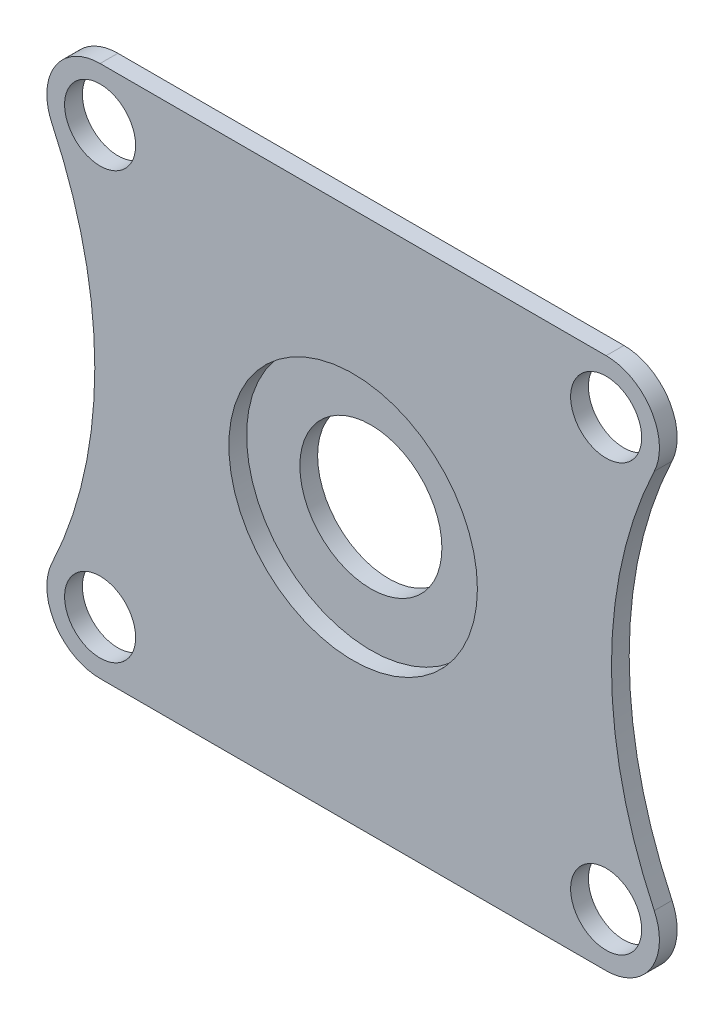
from build123d import *

# Parameters (mm, degrees)
SKETCH_2_R          = 2
EXTRUDE_1_DEPTH     = 1
FILLET_1_R          = 10
FILLET_2_R          = 10
SKETCH_4_R          = 4
CUT_EXTRUDE_1_DEPTH = 10
SKETCH_5_R          = 7
CUT_EXTRUDE_2_DEPTH = 1


with BuildPart() as part:
    # 草图2 → 凸台-拉伸1 (new body)
    with BuildSketch(Plane.XY):
        with BuildLine():
            Line((-14.25, 15), (14.25, 15))
            ThreePointArc((14.25, 15), (16.785462764, 13.603567451), (16.960523709, 10.714285714))
            ThreePointArc((16.960523709, 10.714285714), (14.548221281, 0), (16.960523709, -10.714285714))
            ThreePointArc((16.960523709, -10.714285714), (16.785462764, -13.603567451), (14.25, -15))
            Line((14.25, -15), (-14.25, -15))
            ThreePointArc((-14.25, -15), (-16.785462764, -13.603567451), (-16.960523709, -10.714285714))
            ThreePointArc((-16.960523709, -10.714285714), (-14.548221281, 0), (-16.960523709, 10.714285714))
            ThreePointArc((-16.960523709, 10.714285714), (-16.785462764, 13.603567451), (-14.25, 15))
        make_face()
        with Locations((14.25, 12)):
            Circle(SKETCH_2_R, mode=Mode.SUBTRACT)
        with Locations((-14.25, 12)):
            Circle(SKETCH_2_R, mode=Mode.SUBTRACT)
        with Locations((-14.25, -12)):
            Circle(SKETCH_2_R, mode=Mode.SUBTRACT)
        with Locations((14.25, -12)):
            Circle(SKETCH_2_R, mode=Mode.SUBTRACT)
    extrude(amount=EXTRUDE_1_DEPTH)

    # 草图3 → 旋转1 (revolve)
    with BuildSketch(Plane(origin=(0, 0, 0), x_dir=(1, 0, 0), z_dir=(0, 1, 0)), mode=Mode.PRIVATE) as revolve_1_sk:
        Polygon((0, 1), (8, 1), (12, 0), (0, 0), align=None)
    revolve(revolve_1_sk.sketch.rotate(Axis((0, 0, 0), (0, 0, 1)), 180), axis=Axis((0, 0, 0), (0, 0, 1)))

    # 圆角1
    fillet_1_edges = [part.edges().sort_by_distance(p)[0] for p in [
        (12, 0, 0),
    ]]
    fillet(fillet_1_edges, radius=FILLET_1_R)

    # 圆角2
    fillet_2_edges = [part.edges().sort_by_distance(p)[0] for p in [
        (8, 0, -1),
    ]]
    fillet(fillet_2_edges, radius=FILLET_2_R)

    # 草图4 → 切除-拉伸1 (cut)
    with BuildSketch(Plane(origin=(0, 0, -1), x_dir=(-1, 0, 0), z_dir=(0, 0, -1))):
        Circle(SKETCH_4_R)
    extrude(amount=-CUT_EXTRUDE_1_DEPTH, mode=Mode.SUBTRACT)

    # 草图5 → 切除-拉伸2 (cut)
    with BuildSketch(Plane.XY.offset(1)):
        Circle(SKETCH_5_R)
    extrude(amount=-CUT_EXTRUDE_2_DEPTH, mode=Mode.SUBTRACT)


solid = part.part
